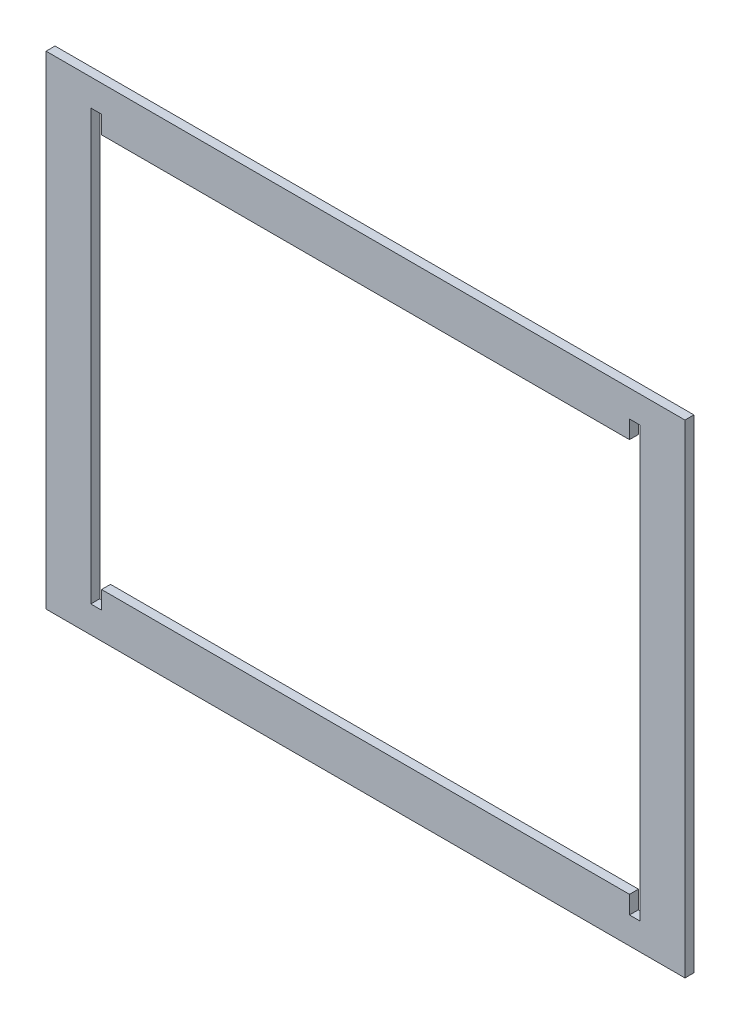
from build123d import *

# Parameters (mm, degrees)
SKETCH1_W          = 357
SKETCH1_H          = 270
SKETCH1_W_2        = 307
SKETCH1_H_2        = 220
EXTRUDE1_DEPTH     = 5
SKETCH3_W          = 6
SKETCH3_H          = 10
CUT_EXTRUDE1_DEPTH = 224.857655665


with BuildPart() as part:
    # Sketch1 → Extrude1 (new body)
    with BuildSketch(Plane.XY):
        Rectangle(SKETCH1_W, SKETCH1_H)
        Rectangle(SKETCH1_W_2, SKETCH1_H_2, mode=Mode.SUBTRACT)
    extrude(amount=EXTRUDE1_DEPTH)

    # Sketch3 → Cut-Extrude1 (cut, through all)
    with BuildSketch(Plane.XY.offset(5)):
        with Locations((-150.5, 115)):
            Rectangle(SKETCH3_W, SKETCH3_H)
        with Locations((150.5, 115)):
            Rectangle(SKETCH3_W, SKETCH3_H)
        with Locations((150.5, -115)):
            Rectangle(SKETCH3_W, SKETCH3_H)
        with Locations((-150.5, -115)):
            Rectangle(SKETCH3_W, SKETCH3_H)
    extrude(amount=-CUT_EXTRUDE1_DEPTH, mode=Mode.SUBTRACT)


solid = part.part
